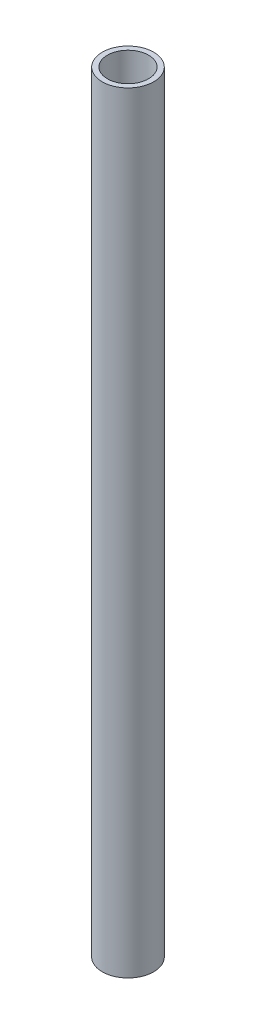
from build123d import *

# Parameters (mm, degrees)
SKETCH_1_R      = 5
SKETCH_1_R_2    = 4
EXTRUDE_1_DEPTH = 150


with BuildPart() as part:
    # 草图1 → 凸台-拉伸1 (new body)
    with BuildSketch(Plane(origin=(0, 0, 0), x_dir=(1, 0, 0), z_dir=(0, 1, 0))):
        with Locations(Location((0, 0, 0), (0, 0, 270))):
            Circle(SKETCH_1_R)
        with Locations(Location((0, 0, 0), (0, 0, 270))):
            Circle(SKETCH_1_R_2, mode=Mode.SUBTRACT)
    extrude(amount=EXTRUDE_1_DEPTH)


solid = part.part
